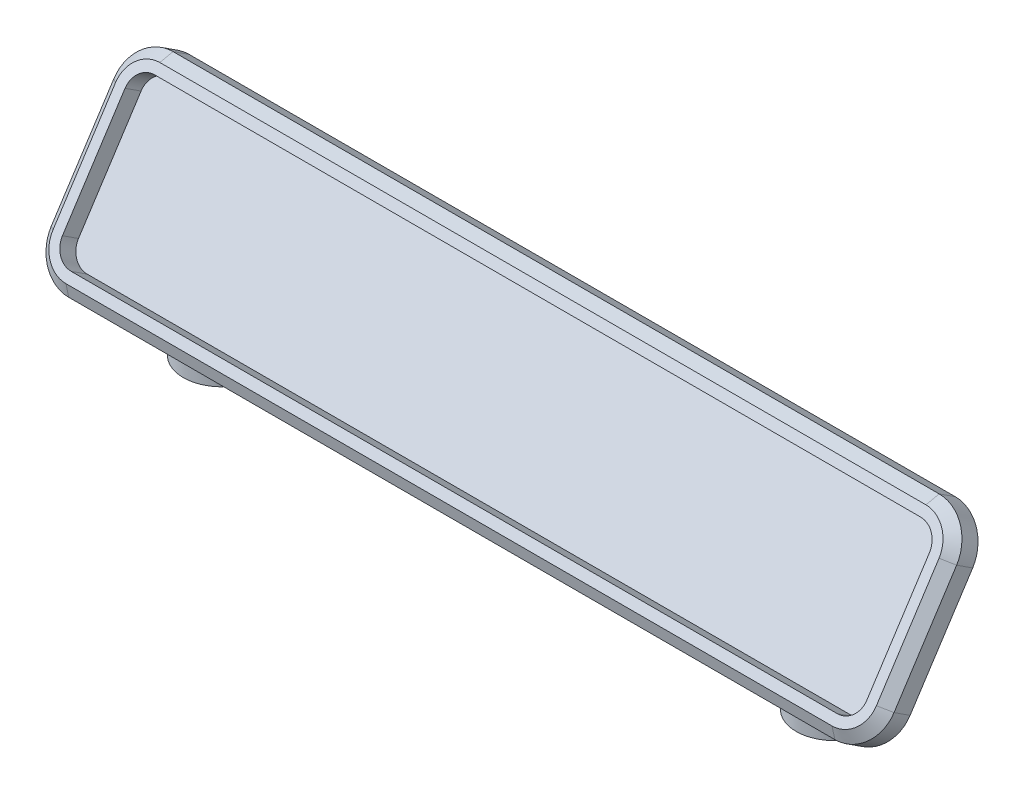
from build123d import *

# Parameters (mm, degrees)
SKETCH2_R             = 6.35
BOSS_EXTRUDE1_DEPTH   = 19.05
BOSS_EXTRUDE1_2_DEPTH = 19.05
BOSS_EXTRUDE2_DEPTH   = 6.35
BOSS_EXTRUDE3_REACH   = 75.737
CUT_EXTRUDE1_DEPTH    = 3.175
CHAMFER2_SIZE         = 1.5875
HOLE1_D               = 5.715
HOLE1_DEPTH           = 10.16
HOLE1_CBORE_D         = 6.985
HOLE1_CBORE_DEPTH     = 0.6858


with BuildPart() as part:
    # Sketch2 → Boss-Extrude1 (new body)
    with BuildSketch(Plane(origin=(0, 0, 0), x_dir=(1, 0, 0), z_dir=(0, 1, 0))):
        with Locations((-50.8, 0)):
            Circle(SKETCH2_R)
    extrude(amount=BOSS_EXTRUDE1_DEPTH)



with BuildPart() as body_2:
    # Sketch2 → Boss-Extrude1 2 (new body)
    with BuildSketch(Plane(origin=(0, 0, 0), x_dir=(1, 0, 0), z_dir=(0, 1, 0))):
        with Locations((50.8, 0)):
            Circle(SKETCH2_R)
    extrude(amount=BOSS_EXTRUDE1_2_DEPTH)


with BuildPart() as part_1:
    add(part.part)

    add(body_2.part)  # Boss-Extrude2 merges body 2
    # Sketch3 → Boss-Extrude2 (add)
    with BuildSketch(Plane(origin=(0, 5.650833475, 8.701520484), x_dir=(-1, 0, 0), z_dir=(0, 0.5446390350150281, 0.8386705679454234))):
        with BuildLine():
            ThreePointArc((-69.85, -25.501674319), (-67.990128061, -29.99180238), (-63.5, -31.851674319))
            Line((-63.5, -31.851674319), (63.5, -31.851674319))
            ThreePointArc((63.5, -31.851674319), (67.990128061, -29.99180238), (69.85, -25.501674319))
            Line((69.85, -25.501674319), (69.85, -6.451674319))
            ThreePointArc((69.85, -6.451674319), (67.990128061, -1.961546259), (63.5, -0.101674319))
            Line((63.5, -0.101674319), (-63.5, -0.101674319))
            ThreePointArc((-63.5, -0.101674319), (-67.990128061, -1.961546259), (-69.85, -6.451674319))
            Line((-69.85, -6.451674319), (-69.85, -25.501674319))
        make_face()
    extrude(amount=BOSS_EXTRUDE2_DEPTH)

    # Sketch8 → Boss-Extrude3 (add, up to next)
    with BuildSketch(Plane(origin=(0, 19.05, 0), x_dir=(1, 0, 0), z_dir=(0, 1, 0)), mode=Mode.PRIVATE) as boss_extrude3_sk1:
        with BuildLine():
            ThreePointArc((57.15, 0), (50.8, 6.35), (44.45, 0))
            Line((44.45, 0), (57.15, 0))
        make_face()
    boss_extrude3_tool1 = extrude(boss_extrude3_sk1.sketch, amount=BOSS_EXTRUDE3_REACH, mode=Mode.PRIVATE) - part_1.part
    # Sketch8 → Boss-Extrude3 (add, up to next)
    with BuildSketch(Plane(origin=(0, 19.05, 0), x_dir=(1, 0, 0), z_dir=(0, 1, 0)), mode=Mode.PRIVATE) as boss_extrude3_sk2:
        with BuildLine():
            ThreePointArc((-44.45, 0), (-50.8, 6.35), (-57.15, 0))
            Line((-57.15, 0), (-44.45, 0))
        make_face()
    boss_extrude3_tool2 = extrude(boss_extrude3_sk2.sketch, amount=BOSS_EXTRUDE3_REACH, mode=Mode.PRIVATE) - part_1.part
    add(boss_extrude3_tool1.solids().sort_by_distance((50.8, 19.05, -2.695024))[0])
    add(boss_extrude3_tool2.solids().sort_by_distance((-50.8, 19.05, -2.695024))[0])

    # Sketch9 → Cut-Extrude1 (cut)
    with BuildSketch(Plane(origin=(0, 9.109291347, 14.02707859), x_dir=(1, 0, 0), z_dir=(0, 0.5446390350150282, 0.8386705679454234))):
        with BuildLine():
            Line((63.5, 28.676674319), (-63.5, 28.676674319))
            ThreePointArc((-63.5, 28.676674319), (-65.74506403, 27.74673835), (-66.675, 25.501674319))
            Line((-66.675, 25.501674319), (-66.675, 6.451674319))
            ThreePointArc((-66.675, 6.451674319), (-65.74506403, 4.206610289), (-63.5, 3.276674319))
            Line((-63.5, 3.276674319), (63.5, 3.276674319))
            ThreePointArc((63.5, 3.276674319), (65.74506403, 4.206610289), (66.675, 6.451674319))
            Line((66.675, 6.451674319), (66.675, 25.501674319))
            ThreePointArc((66.675, 25.501674319), (65.74506403, 27.74673835), (63.5, 28.676674319))
        make_face()
    extrude(amount=-CUT_EXTRUDE1_DEPTH, mode=Mode.SUBTRACT)

    # Chamfer2
    chamfer2_edges = [part_1.edges().sort_by_distance(p)[0] for p in [
        (-69.85, 19.05, 0),
        (0, 32.363895266, -8.646144681),
        (69.85, 19.05, 0),
        (0, 5.736104734, 8.646144681),
        (0, 9.194562606, 13.971702787),
        (-69.85, 22.508457872, 5.325558106),
        (69.85, 22.508457872, 5.325558106),
        (0, 35.822353138, -3.320586574),
        (67.990128061, 30.80407541, -7.633185823),
        (-67.990128061, 30.80407541, -7.633185823),
        (67.990128061, 7.29592459, 7.633185823),
        (-67.990128061, 7.29592459, 7.633185823),
        (67.990128061, 10.754382462, 12.958743929),
        (-67.990128061, 10.754382462, 12.958743929),
        (67.990128061, 34.262533283, -2.307627716),
        (-67.990128061, 34.262533283, -2.307627716),
    ]]
    chamfer(chamfer2_edges, length=CHAMFER2_SIZE)

    # Hole1
    with Locations(Plane(origin=(-50.8, 0, 0), x_dir=(0, 0, -1), z_dir=(0, -1, 0))):
        with Locations((0, 0), (0, 101.6)):
            CounterBoreHole(HOLE1_D / 2, HOLE1_CBORE_D / 2, HOLE1_CBORE_DEPTH, depth=HOLE1_DEPTH)


solid = part_1.part
